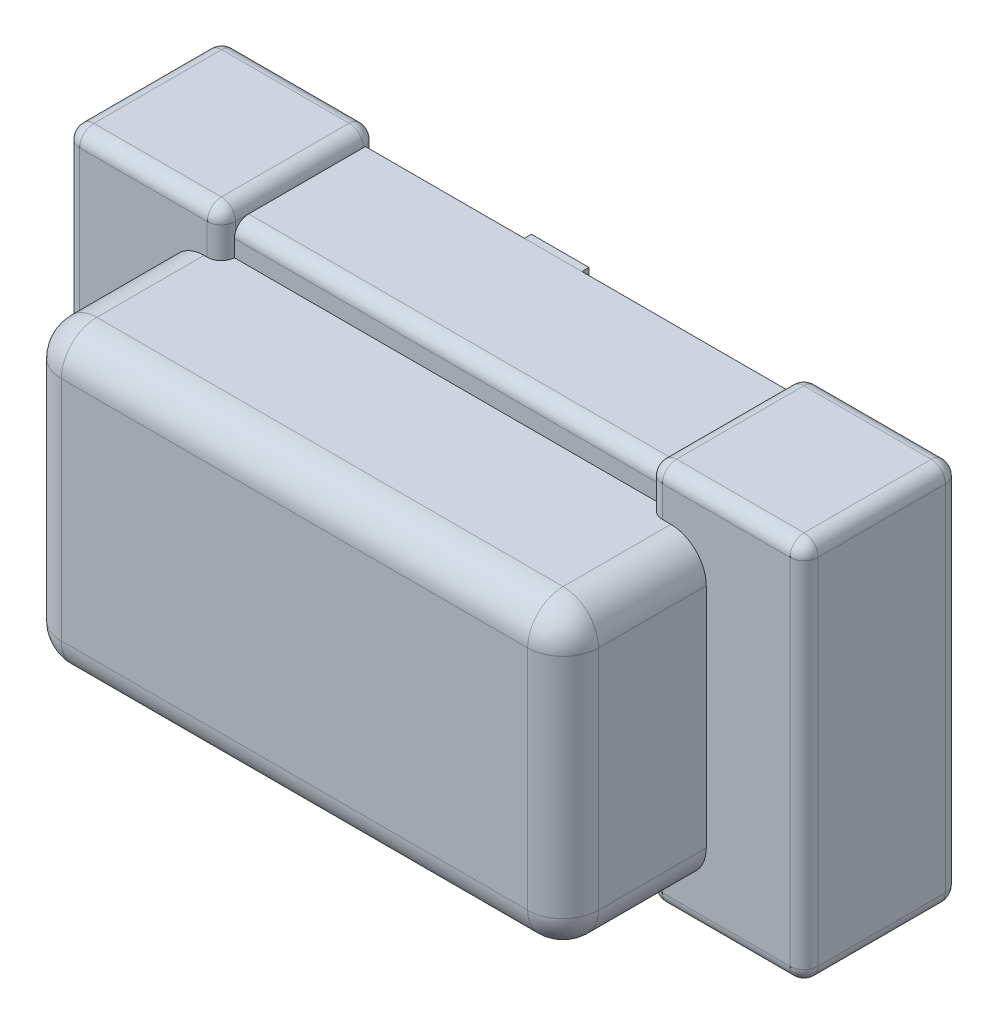
from build123d import *

# Parameters (mm, degrees)
SKETCH3_W                  = 1
SKETCH3_H                  = 0.5
BOSS_EXTRUDE1_DEPTH        = 0.184822483
SKETCH6_W                  = 0.071813071
SKETCH6_H                  = 0.214176685
BOSS_EXTRUDE5_DEPTH        = 0.01
BOSS_EXTRUDE9_DEPTH        = 0.52
BOSS_EXTRUDE9_DEPTH_BACK   = 0.02
SKETCH4_W                  = 0.22
SKETCH4_H                  = 0.220337521
BOSS_EXTRUDE9_2_DEPTH      = 0.52
BOSS_EXTRUDE9_2_DEPTH_BACK = 0.02
SKETCH4_H_2                = 0.21963888
SKETCH7_W                  = 0.758458257
SKETCH7_H                  = 0.420745525
BOSS_EXTRUDE10_DEPTH       = 0.22
FILLET4_R                  = 0.05
FILLET7_R                  = 0.02
FILLET8_R                  = 0.02
FILLET9_R                  = 0.02


with BuildPart() as part:
    # Sketch3 → Boss-Extrude1 (new body)
    with BuildSketch(Plane.XY):
        with Locations((0.5, 0.25)):
            Rectangle(SKETCH3_W, SKETCH3_H)
    extrude(amount=BOSS_EXTRUDE1_DEPTH)

    # Fillet9
    fillet9_edges = [part.edges().sort_by_distance(p)[0] for p in [
        (0.5, 0.5, 0.184822483),
        (0.5, 0, 0.184822483),
    ]]
    fillet(fillet9_edges, radius=FILLET9_R)


with BuildPart() as body_2:
    # Sketch6 → Boss-Extrude5 (new body)
    with BuildSketch(Plane(origin=(0, 0, 0), x_dir=(-1, 0, 0), z_dir=(0, 0, -1))):
        Polygon((-0.503719115, 0), (-0.422427341, 0), (-0.422427341, 0.5), (-0.503719115, 0.5), (-0.503719115, 0.347493202), (-0.503719115, 0.133316517), align=None)
        with Locations((-0.53962565, 0.24040486)):
            Rectangle(SKETCH6_W, SKETCH6_H)
    extrude(amount=BOSS_EXTRUDE5_DEPTH)


with BuildPart() as body_3:
    # Sketch4 → Boss-Extrude9 (new, two sides: drawn at the far end of the back side and taken through both)
    with BuildSketch(Plane(origin=(0, 0, 0), x_dir=(1, 0, 0), z_dir=(0, 1, 0)).offset(-BOSS_EXTRUDE9_DEPTH_BACK)):
        with Locations((0.088, -0.093168761)):
            Rectangle(SKETCH4_W, SKETCH4_H)
    extrude(amount=BOSS_EXTRUDE9_DEPTH + BOSS_EXTRUDE9_DEPTH_BACK)

    # Fillet8
    fillet8_edges = [body_3.edges().sort_by_distance(p)[0] for p in [
        (-0.022, 0.52, 0.093168761),
        (0.198, -0.02, 0.093168761),
        (0.088, 0.52, 0.203337521),
        (0.198, 0.52, 0.093168761),
        (0.088, 0.52, -0.017),
        (0.088, -0.02, -0.017),
        (-0.022, -0.02, 0.093168761),
        (-0.022, 0.25, -0.017),
        (0.198, 0.25, -0.017),
        (0.198, 0.25, 0.203337521),
        (-0.022, 0.25, 0.203337521),
        (0.088, -0.02, 0.203337521),
    ]]
    fillet(fillet8_edges, radius=FILLET8_R)


with BuildPart() as body_4:
    # Sketch4 → Boss-Extrude9 2 (new, two sides: drawn at the far end of the back side and taken through both)
    with BuildSketch(Plane(origin=(0, 0, 0), x_dir=(1, 0, 0), z_dir=(0, 1, 0)).offset(-BOSS_EXTRUDE9_2_DEPTH_BACK)):
        with Locations((0.91, -0.09281944)):
            Rectangle(SKETCH4_W, SKETCH4_H_2)
    extrude(amount=BOSS_EXTRUDE9_2_DEPTH + BOSS_EXTRUDE9_2_DEPTH_BACK)

    # Fillet7
    fillet7_edges = [body_4.edges().sort_by_distance(p)[0] for p in [
        (1.02, 0.52, 0.09281944),
        (0.8, -0.02, 0.09281944),
        (0.91, 0.52, -0.017),
        (0.8, 0.52, 0.09281944),
        (0.91, 0.52, 0.20263888),
        (0.91, -0.02, 0.20263888),
        (1.02, -0.02, 0.09281944),
        (1.02, 0.25, 0.20263888),
        (0.8, 0.25, 0.20263888),
        (0.8, 0.25, -0.017),
        (1.02, 0.25, -0.017),
        (0.91, -0.02, -0.017),
    ]]
    fillet(fillet7_edges, radius=FILLET7_R)


with BuildPart() as body_5:
    # Sketch7 → Boss-Extrude10 (new body)
    with BuildSketch(Plane.XY.offset(0.184822483)):
        with Locations((0.502724716, 0.24595369)):
            Rectangle(SKETCH7_W, SKETCH7_H)
    extrude(amount=BOSS_EXTRUDE10_DEPTH)

    # Fillet4
    fillet4_edges = [body_5.edges().sort_by_distance(p)[0] for p in [
        (0.123495587, 0.24595369, 0.404822483),
        (0.502724715, 0.035580927, 0.404822483),
        (0.881953844, 0.24595369, 0.404822483),
        (0.881953844, 0.035580927, 0.294822483),
        (0.123495587, 0.035580927, 0.294822483),
        (0.123495587, 0.456326452, 0.294822483),
        (0.881953844, 0.456326452, 0.294822483),
        (0.502724715, 0.456326452, 0.404822483),
    ]]
    fillet(fillet4_edges, radius=FILLET4_R)


solid = Compound([part.part, body_2.part, body_3.part, body_4.part, body_5.part])
